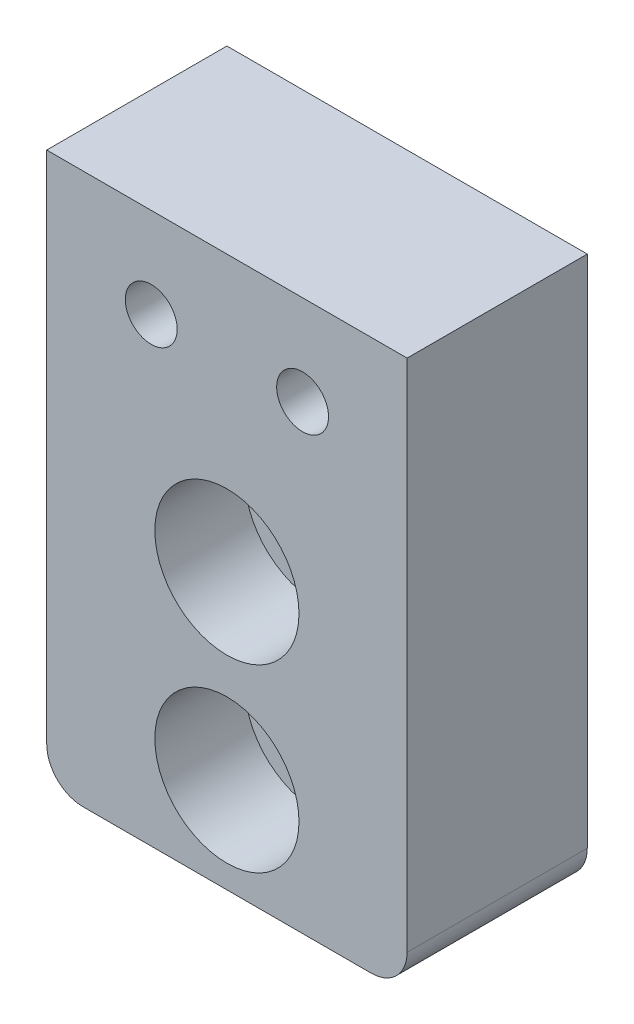
from build123d import *

# Parameters (mm, degrees)
SKETCH1_W                                        = 25.4
SKETCH1_H                                        = 38.8112
BOSS_EXTRUDE1_DEPTH                              = 12.7
CBORE_FOR_1_4_BUTTON_HEAD_CAP_SCREW1_D           = 6.5278
CBORE_FOR_1_4_BUTTON_HEAD_CAP_SCREW1_CBORE_D     = 10.16
CBORE_FOR_1_4_BUTTON_HEAD_CAP_SCREW1_CBORE_DEPTH = 6.35
FILLET1_R                                        = 2.54
CBORE_FOR_6_BUTTON_HEAD_CAP_SCREW1_D             = 3.6576
CBORE_FOR_6_BUTTON_HEAD_CAP_SCREW1_CBORE_D       = 6.096
CBORE_FOR_6_BUTTON_HEAD_CAP_SCREW1_CBORE_DEPTH   = 3.556


with BuildPart() as part:
    # Sketch1 → Boss-Extrude1 (new body)
    with BuildSketch(Plane.XY):
        with Locations((12.7, 19.4056)):
            Rectangle(SKETCH1_W, SKETCH1_H)
    extrude(amount=BOSS_EXTRUDE1_DEPTH)

    # CBORE for 1/4 Button Head Cap Screw1 (through all)
    with Locations(Plane.XY.offset(12.7)):
        with Locations((12.7, 6.7056), (12.7, 19.4056)):
            CounterBoreHole(CBORE_FOR_1_4_BUTTON_HEAD_CAP_SCREW1_D / 2, CBORE_FOR_1_4_BUTTON_HEAD_CAP_SCREW1_CBORE_D / 2, CBORE_FOR_1_4_BUTTON_HEAD_CAP_SCREW1_CBORE_DEPTH)

    # Fillet1
    fillet1_edges = [part.edges().sort_by_distance(p)[0] for p in [
        (25.4, 0, 6.35),
        (0, 0, 6.35),
    ]]
    fillet(fillet1_edges, radius=FILLET1_R)

    # CBORE for #6 Button Head Cap Screw1 (through all)
    with Locations(Plane(origin=(0, 0, 0), x_dir=(-1, 0, 0), z_dir=(0, 0, -1))):
        with Locations((-7.366, 32.4612), (-18.034, 32.4612)):
            CounterBoreHole(CBORE_FOR_6_BUTTON_HEAD_CAP_SCREW1_D / 2, CBORE_FOR_6_BUTTON_HEAD_CAP_SCREW1_CBORE_D / 2, CBORE_FOR_6_BUTTON_HEAD_CAP_SCREW1_CBORE_DEPTH)


solid = part.part
